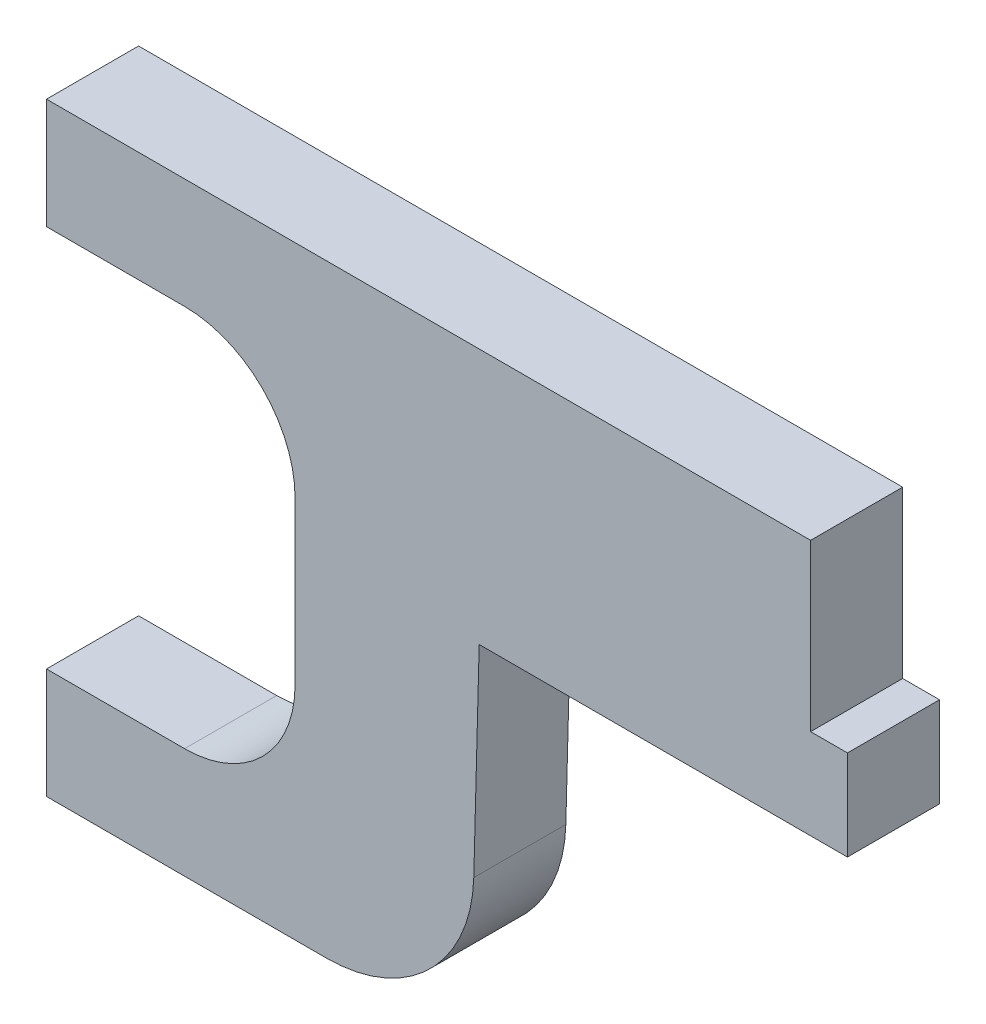
from build123d import *

# Parameters (mm, degrees)
BOSS_EXTRUDE1_DEPTH = 0.125
FILLET1_R           = 0.3
FILLET2_R           = 0.4


with BuildPart() as part:
    # frame_outline → Boss-Extrude1 (new, symmetric)
    with BuildSketch(Plane.XY):
        Polygon((0, 1.64), (0, 1.34), (0.675, 1.34), (0.675, 0.3), (0, 0.3), (0, 0), (1.15, 0), (1.175, 0.945), (2.175, 0.945), (2.175, 1.19), (2.075, 1.19), (2.075, 1.64), (0.7, 1.64), align=None)
    extrude(amount=BOSS_EXTRUDE1_DEPTH, both=True)

    # Fillet1
    fillet1_edges = [part.edges().sort_by_distance(p)[0] for p in [
        (0.675, 0.3, 0),
        (0.675, 1.34, 0),
    ]]
    fillet(fillet1_edges, radius=FILLET1_R)

    # Fillet2
    fillet2_edges = [part.edges().sort_by_distance(p)[0] for p in [
        (1.15, 0, 0),
    ]]
    fillet(fillet2_edges, radius=FILLET2_R)


solid = part.part
